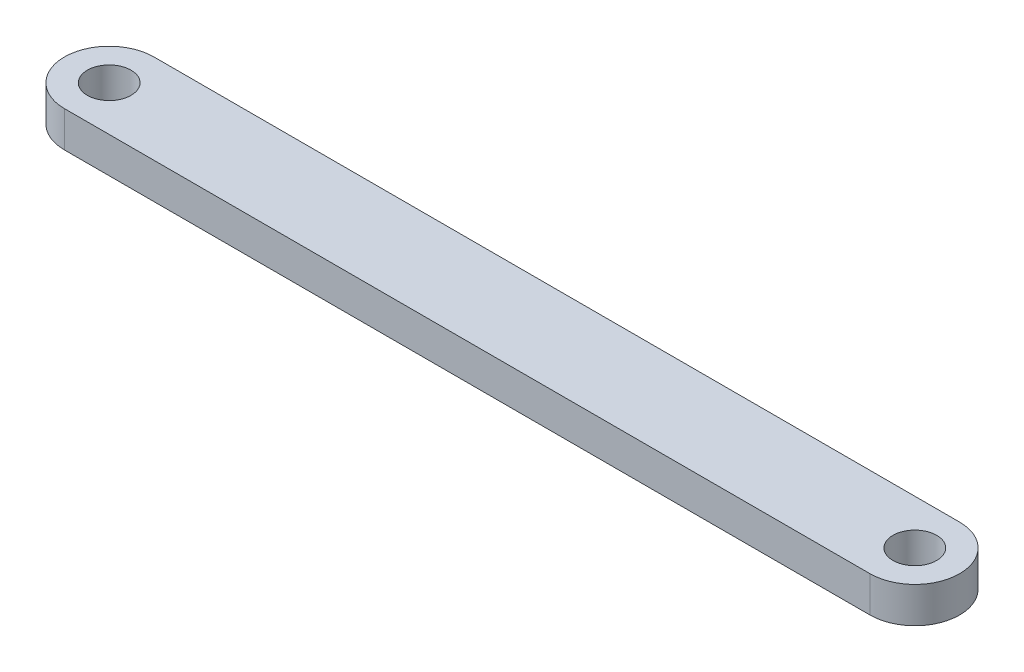
from build123d import *

# Parameters (mm, degrees)
SKETCH1_R           = 1.55
BOSS_EXTRUDE2_DEPTH = 2.54


with BuildPart() as part:
    # Sketch1 → Boss-Extrude2 (new body)
    with BuildSketch(Plane(origin=(0, 0, 0), x_dir=(1, 0, 0), z_dir=(0, 1, 0))):
        with BuildLine():
            Line((-3.114406286, 3.183125141), (54.035593714, 3.183125141))
            ThreePointArc((54.035593714, 3.183125141), (57.210593714, 0.008125141), (54.035593714, -3.166874859))
            Line((54.035593714, -3.166874859), (-3.114406286, -3.166874859))
            ThreePointArc((-3.114406286, -3.166874859), (-6.289406286, 0.008125141), (-3.114406286, 3.183125141))
        make_face()
        with Locations(Location((-3.114406286, 0.008125141, 0), (0, 0, 270))):
            Circle(SKETCH1_R, mode=Mode.SUBTRACT)
        with Locations(Location((54.035593714, 0.008125141, 0), (0, 0, 270))):
            Circle(SKETCH1_R, mode=Mode.SUBTRACT)
    extrude(amount=BOSS_EXTRUDE2_DEPTH)


solid = part.part
